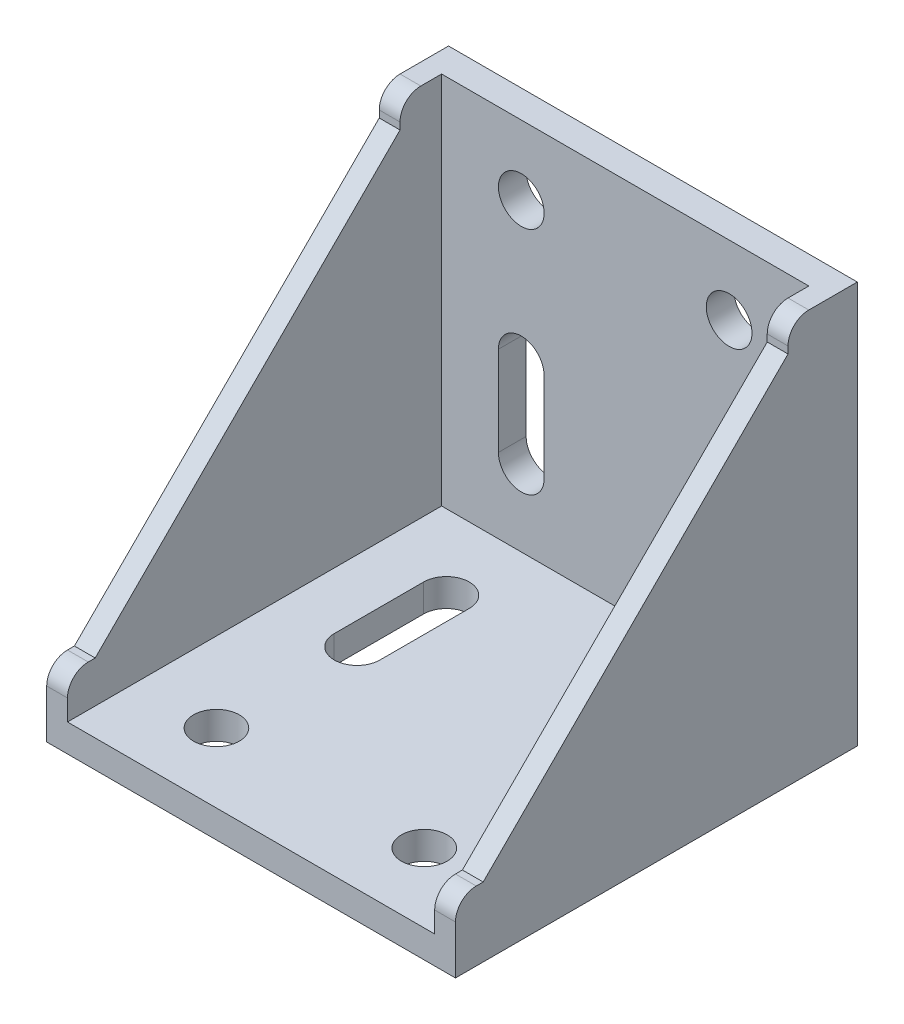
from build123d import *

# Parameters (mm, degrees)
SKETCH_1_W      = 59
SKETCH_1_H      = 58
SKETCH_1_R      = 3.3
EXTRUDE_1_DEPTH = 4
EXTRUDE_3_DEPTH = 3
EXTRUDE_START   = -3
EXTRUDE_6_DEPTH = 3
SKETCH_4_W      = 59
SKETCH_4_H      = 58
SKETCH_4_R      = 3.3
EXTRUDE_7_DEPTH = 4


with BuildPart() as part:
    # Эскиз1 → Бобышка-Вытянуть1 (new body)
    with BuildSketch(Plane.XY):
        Rectangle(SKETCH_1_W, SKETCH_1_H)
        with Locations((-15, 19)):
            Circle(SKETCH_1_R, mode=Mode.SUBTRACT)
        with Locations((15, 19)):
            Circle(SKETCH_1_R, mode=Mode.SUBTRACT)
        with BuildLine():
            Line((18.3, -14.2), (18.3, -1.3))
            ThreePointArc((18.3, -1.3), (15, 2), (11.7, -1.3))
            Line((11.7, -1.3), (11.7, -14.2))
            ThreePointArc((11.7, -14.2), (15, -17.5), (18.3, -14.2))
        make_face(mode=Mode.SUBTRACT)
        with BuildLine():
            Line((-18.3, -1.3), (-18.3, -14.2))
            ThreePointArc((-18.3, -14.2), (-15, -17.5), (-11.7, -14.2))
            Line((-11.7, -14.2), (-11.7, -1.3))
            ThreePointArc((-11.7, -1.3), (-15, 2), (-18.3, -1.3))
        make_face(mode=Mode.SUBTRACT)
    extrude(amount=EXTRUDE_1_DEPTH)

    # Эскиз5 → Бобышка-Вытянуть3 (add)
    with BuildSketch(Plane.ZY.offset(29.5)):
        with BuildLine():
            Line((0, 29), (7, 29))
            ThreePointArc((7, 29), (9.121320344, 28.121320344), (10, 26))
            Line((10, 26), (10, 25))
            Line((10, 25), (54, -19))
            Line((54, -19), (55, -19))
            ThreePointArc((55, -19), (57.121320344, -19.878679656), (58, -22))
            Line((58, -22), (58, -29))
            Line((58, -29), (0, -29))
            Line((0, -29), (0, 29))
        make_face()
    extrude(amount=-EXTRUDE_3_DEPTH)

    # Эскиз6 → Бобышка-Вытянуть6 (add)
    with BuildSketch(Plane(origin=(29.5, 0, 0), x_dir=(0, 0, -1), z_dir=(1, 0, 0)).offset(EXTRUDE_START)):
        with BuildLine():
            Line((0, 29), (0, -29))
            Line((0, -29), (-58, -29))
            Line((-58, -29), (-58, -22))
            ThreePointArc((-58, -22), (-57.121320344, -19.878679656), (-55, -19))
            Line((-55, -19), (-54, -19))
            Line((-54, -19), (-10, 25))
            Line((-10, 25), (-10, 26))
            ThreePointArc((-10, 26), (-9.121320344, 28.121320344), (-7, 29))
            Line((-7, 29), (0, 29))
        make_face()
    extrude(amount=EXTRUDE_6_DEPTH)

    # Эскиз4 → Бобышка-Вытянуть7 (add)
    with BuildSketch(Plane(origin=(0, -29, 0), x_dir=(-1, 0, 0), z_dir=(0, -1, 0))):
        with Locations((-5.17e-07, -29.000001301)):
            Rectangle(SKETCH_4_W, SKETCH_4_H)
        with Locations(Location((14.999999483, -48.000001301, 0), (0, 0, 270))):
            Circle(SKETCH_4_R, mode=Mode.SUBTRACT)
        with Locations(Location((-15.000000517, -48.000001301, 0), (0, 0, 270))):
            Circle(SKETCH_4_R, mode=Mode.SUBTRACT)
        with BuildLine():
            Line((11.699999483, -27.700001301), (11.699999483, -14.800001301))
            ThreePointArc((11.699999483, -14.800001301), (14.999999483, -11.500001301), (18.299999483, -14.800001301))
            Line((18.299999483, -14.800001301), (18.299999483, -27.700001301))
            ThreePointArc((18.299999483, -27.700001301), (14.999999483, -31.000001301), (11.699999483, -27.700001301))
        make_face(mode=Mode.SUBTRACT)
        with BuildLine():
            Line((-11.700000517, -14.800001301), (-11.700000517, -27.700001301))
            ThreePointArc((-11.700000517, -27.700001301), (-15.000000517, -31.000001301), (-18.300000517, -27.700001301))
            Line((-18.300000517, -27.700001301), (-18.300000517, -14.800001301))
            ThreePointArc((-18.300000517, -14.800001301), (-15.000000517, -11.500001301), (-11.700000517, -14.800001301))
        make_face(mode=Mode.SUBTRACT)
    extrude(amount=-EXTRUDE_7_DEPTH)


solid = part.part
